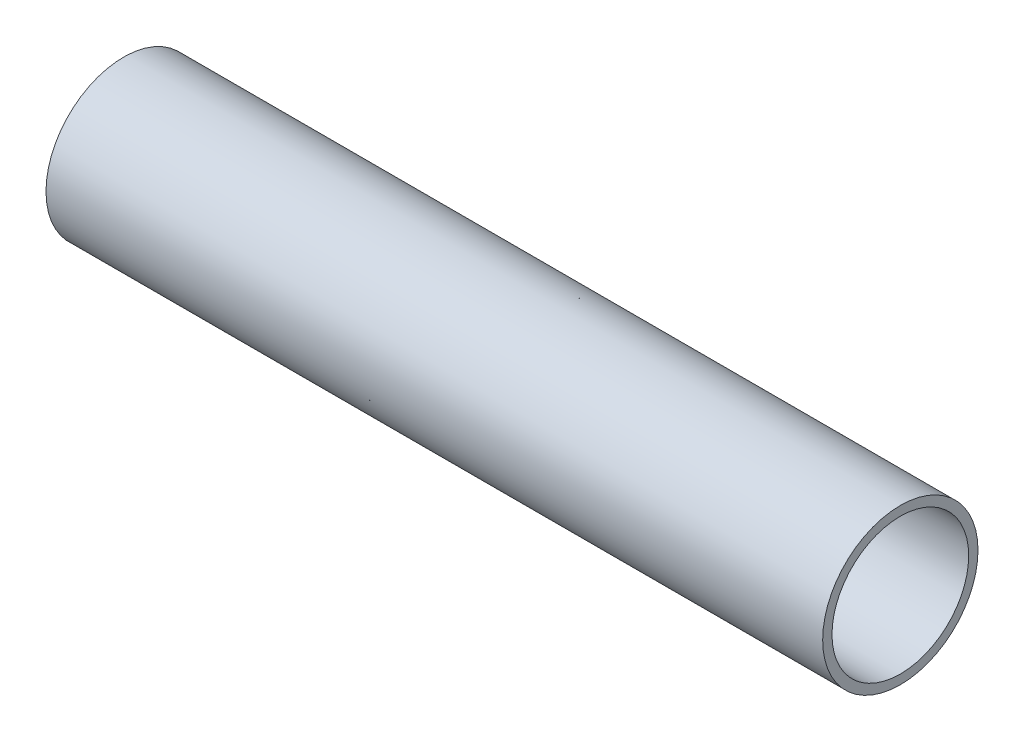
from build123d import *

# Parameters (mm, degrees)
SKETCH_1_R      = 25
SKETCH_1_R_2    = 22
EXTRUDE_1_DEPTH = 125
EXTRUDE_START   = 125
SKETCH_4_R      = 25
SKETCH_4_R_2    = 22
EXTRUDE_2_DEPTH = 125


with BuildPart() as part:
    # Эскиз1 → Бобышка-Вытянуть1 (new body)
    with BuildSketch(Plane(origin=(0, 0, 0), x_dir=(0, 0, -1), z_dir=(1, 0, 0))):
        Circle(SKETCH_1_R)
        Circle(SKETCH_1_R_2, mode=Mode.SUBTRACT)
    extrude(amount=EXTRUDE_1_DEPTH)

    # Эскиз4 → Бобышка-Вытянуть2 (add)
    with BuildSketch(Plane.ZY.offset(EXTRUDE_START)):
        Circle(SKETCH_4_R)
        Circle(SKETCH_4_R_2, mode=Mode.SUBTRACT)
    extrude(amount=-EXTRUDE_2_DEPTH)


solid = part.part
